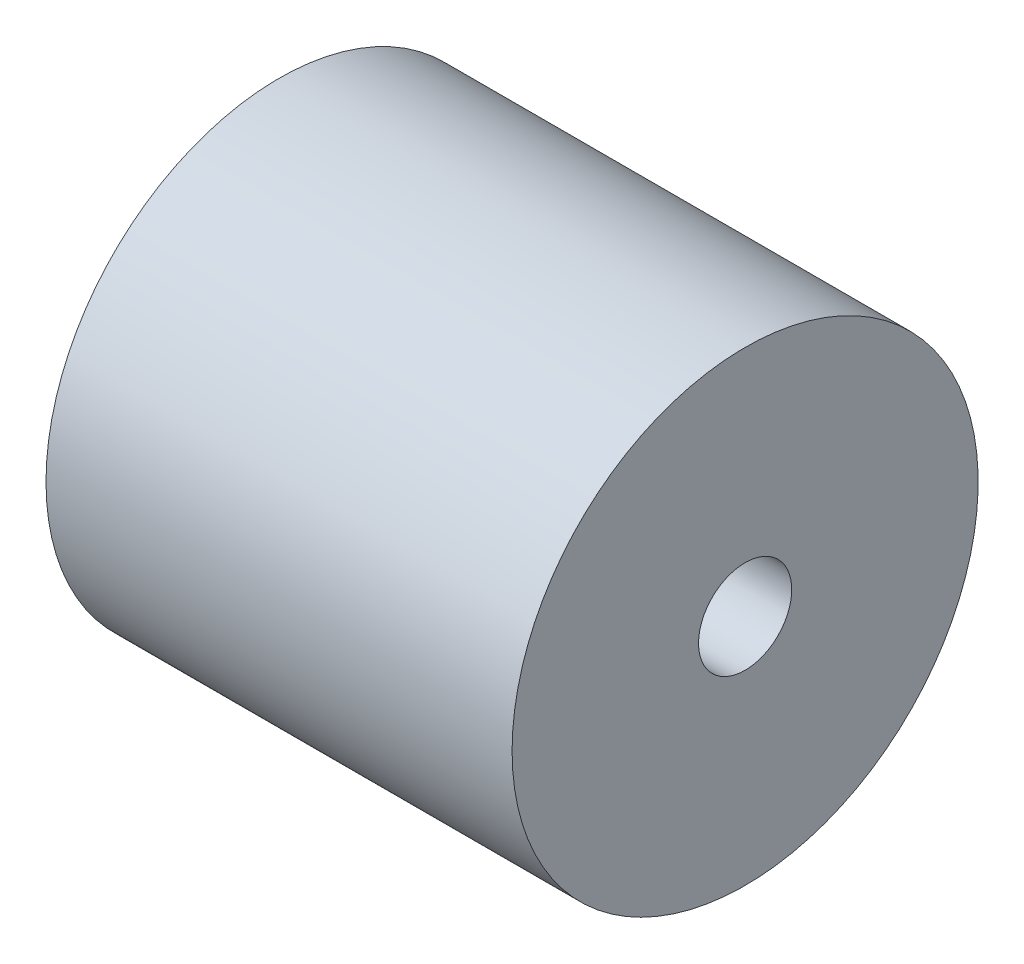
from build123d import *

# Parameters (mm, degrees)
SKETCH1_W = 63.5
SKETCH1_H = 25.4


with BuildPart() as part:
    # Sketch1 → Revolve1 (revolve)
    with BuildSketch(Plane.XY, mode=Mode.PRIVATE) as revolve1_sk:
        with Locations((31.75, 19.05)):
            Rectangle(SKETCH1_W, SKETCH1_H)
    revolve(revolve1_sk.sketch.rotate(Axis((63.5, 0, 0), (1, 0, 0)), 90), axis=Axis((63.5, 0, 0), (1, 0, 0)))


solid = part.part
